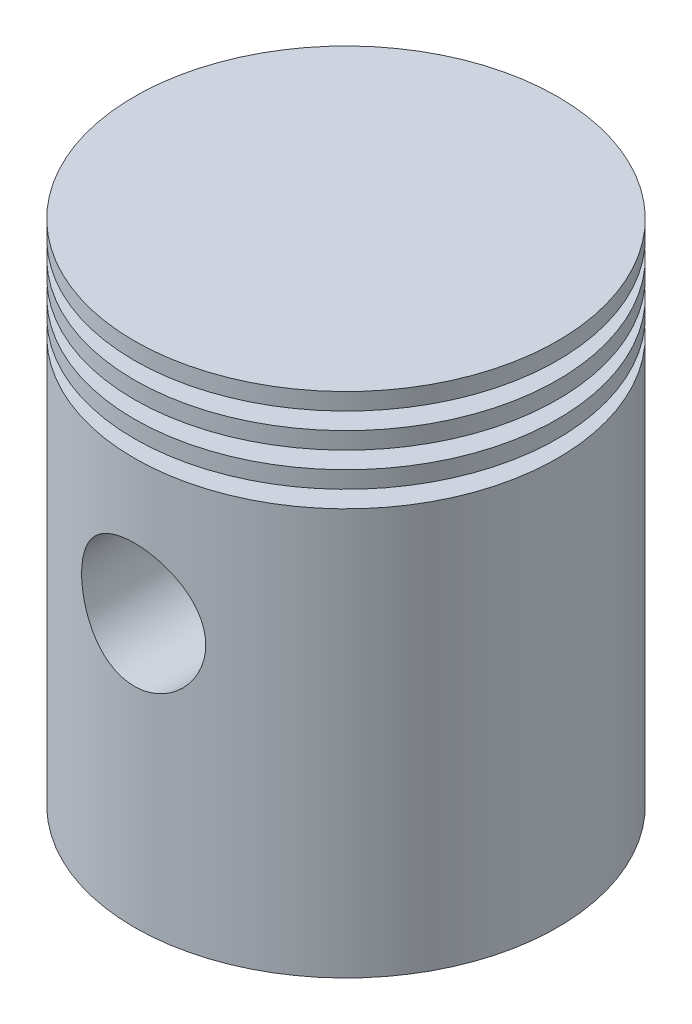
from build123d import *

# Parameters (mm, degrees)
BOSS_EXTRUDE4_REACH      = 119.463
BOSS_EXTRUDE4_END_RADIUS = 37.5
BOSS_EXTRUDE4_START      = -13
SKETCH2_R                = 15
BOSS_EXTRUDE5_REACH      = 119.463
BOSS_EXTRUDE5_END_RADIUS = 37.5
BOSS_EXTRUDE5_START      = 13
SKETCH2_3_R              = 15
CUT_EXTRUDE2_DEPTH       = 50
CUT_EXTRUDE2_DEPTH_BACK  = 50
SKETCH4_R                = 11


with BuildPart() as part:
    # Sketch1 → Revolve1 (revolve)
    with BuildSketch(Plane.XY):
        with BuildLine():
            Line((32.5, 0), (37.5, 0))
            Line((37.5, 0), (37.5, 72))
            Line((37.5, 72), (32.5, 72))
            Line((32.5, 72), (32.5, 75))
            Line((32.5, 75), (37.5, 75))
            Line((37.5, 75), (37.5, 78))
            Line((37.5, 78), (32.5, 78))
            Line((32.5, 78), (32.5, 81))
            Line((32.5, 81), (37.5, 81))
            Line((37.5, 81), (37.5, 84))
            Line((37.5, 84), (32.5, 84))
            Line((32.5, 84), (32.5, 87))
            Line((32.5, 87), (37.5, 87))
            Line((37.5, 87), (37.5, 90))
            Line((37.5, 90), (0, 90))
            Line((0, 90), (0, 85))
            Line((0, 85), (17.5, 85))
            ThreePointArc((17.5, 85), (24.571067812, 82.071067812), (27.5, 75))
            Line((27.5, 75), (27.5, 48))
            Line((27.5, 48), (32.5, 48))
            Line((32.5, 48), (32.5, 0))
        make_face()
    revolve(axis=Axis((0, 0, 0), (0, 1, 0)))

    # Boss-Extrude4: up to this cylinder (the profile starts inside it)
    boss_extrude4_end = Plane(origin=(0, 48, 0), z_dir=(0, -1, 0)) * Cylinder(BOSS_EXTRUDE4_END_RADIUS, 314.926, mode=Mode.PRIVATE)
    # Sketch2 → Boss-Extrude4 (add, up to the surface)
    with BuildSketch(Plane.XY.offset(BOSS_EXTRUDE4_START), mode=Mode.PRIVATE) as boss_extrude4_sk1:
        with Locations((0, 48)):
            Circle(SKETCH2_R)
    boss_extrude4_tool1 = extrude(boss_extrude4_sk1.sketch, amount=-BOSS_EXTRUDE4_REACH, mode=Mode.PRIVATE) & boss_extrude4_end
    add(boss_extrude4_tool1.solids().sort_by_distance((0, 48, -13))[0])

    # Boss-Extrude5: up to this cylinder (the profile starts inside it)
    boss_extrude5_end = Plane(origin=(0, 48, 0), z_dir=(0, -1, 0)) * Cylinder(BOSS_EXTRUDE5_END_RADIUS, 314.926, mode=Mode.PRIVATE)
    # Sketch2<3> → Boss-Extrude5 (add, up to the surface)
    with BuildSketch(Plane.XY.offset(BOSS_EXTRUDE5_START), mode=Mode.PRIVATE) as boss_extrude5_sk1:
        with Locations((0, 48)):
            Circle(SKETCH2_3_R)
    boss_extrude5_tool1 = extrude(boss_extrude5_sk1.sketch, amount=BOSS_EXTRUDE5_REACH, mode=Mode.PRIVATE) & boss_extrude5_end
    add(boss_extrude5_tool1.solids().sort_by_distance((0, 48, 13))[0])

    # Sketch4 → Cut-Extrude2 (cut, two sides: drawn at the far end of the back side and taken through both)
    with BuildSketch(Plane.XY.offset(-CUT_EXTRUDE2_DEPTH_BACK)):
        with Locations((0, 48)):
            Circle(SKETCH4_R)
    extrude(amount=CUT_EXTRUDE2_DEPTH + CUT_EXTRUDE2_DEPTH_BACK, mode=Mode.SUBTRACT)


solid = part.part
